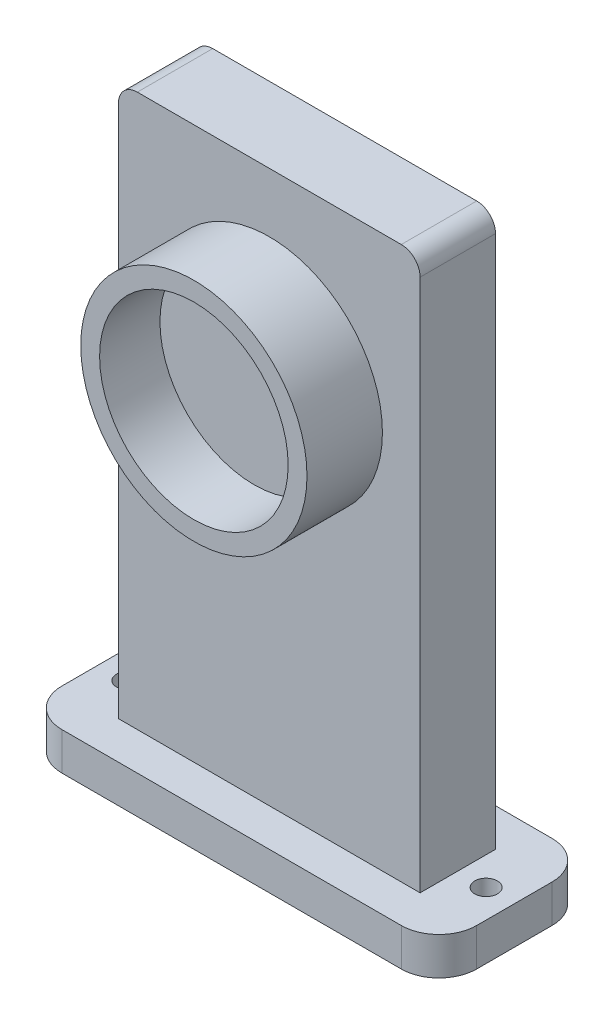
from build123d import *

# Parameters (mm, degrees)
SKETCH1_W           = 40
SKETCH1_H           = 110.7
BOSS_EXTRUDE1_DEPTH = 10
SKETCH4_R           = 15
BOSS_EXTRUDE3_DEPTH = 10
SKETCH5_R           = 12.5
CUT_EXTRUDE2_DEPTH  = 8
SKETCH6_W           = 40
SKETCH6_H           = 10
CUT_EXTRUDE3_DEPTH  = 32.5
FILLET4_R           = 2.5
SKETCH11_R          = 1.5
SKETCH11_W          = 40
SKETCH11_H          = 10
BOSS_EXTRUDE4_DEPTH = 5


with BuildPart() as part:
    # Sketch1 → Boss-Extrude1 (new body)
    with BuildSketch(Plane.XY):
        Rectangle(SKETCH1_W, SKETCH1_H)
    extrude(amount=BOSS_EXTRUDE1_DEPTH)

    # Sketch4 → Boss-Extrude3 (add)
    with BuildSketch(Plane.XY.offset(10)):
        Circle(SKETCH4_R)
    extrude(amount=BOSS_EXTRUDE3_DEPTH)

    # Sketch5 → Cut-Extrude2 (cut)
    with BuildSketch(Plane.XY.offset(20)):
        Circle(SKETCH5_R)
    extrude(amount=-CUT_EXTRUDE2_DEPTH, mode=Mode.SUBTRACT)

    # Sketch6 → Cut-Extrude3 (cut)
    with BuildSketch(Plane(origin=(0, 55.35, 0), x_dir=(1, 0, 0), z_dir=(0, 1, 0))):
        with Locations((0, -5)):
            Rectangle(SKETCH6_W, SKETCH6_H)
    extrude(amount=-CUT_EXTRUDE3_DEPTH, mode=Mode.SUBTRACT)

    # Fillet4
    fillet4_edges = [part.edges().sort_by_distance(p)[0] for p in [
        (-20, 22.85, 5),
        (20, 22.85, 5),
    ]]
    fillet(fillet4_edges, radius=FILLET4_R)

    # Sketch11 → Boss-Extrude4 (add)
    with BuildSketch(Plane.XZ.offset(55.35)):
        with BuildLine():
            Line((-22.5, 15), (22.5, 15))
            ThreePointArc((22.5, 15), (26.035533906, 13.535533906), (27.5, 10))
            Line((27.5, 10), (27.5, 0))
            ThreePointArc((27.5, 0), (26.035533906, -3.535533906), (22.5, -5))
            Line((22.5, -5), (-22.5, -5))
            ThreePointArc((-22.5, -5), (-26.035533906, -3.535533906), (-27.5, 0))
            Line((-27.5, 0), (-27.5, 10))
            ThreePointArc((-27.5, 10), (-26.035533906, 13.535533906), (-22.5, 15))
        make_face()
        with Locations((-23.75, 5)):
            Circle(SKETCH11_R, mode=Mode.SUBTRACT)
        with Locations(Location((23.75, 5, 0), (0, 0, 180))):
            Circle(SKETCH11_R, mode=Mode.SUBTRACT)
        with Locations((0, 5)):
            Rectangle(SKETCH11_W, SKETCH11_H, mode=Mode.SUBTRACT)
    extrude(amount=-BOSS_EXTRUDE4_DEPTH)


solid = part.part
